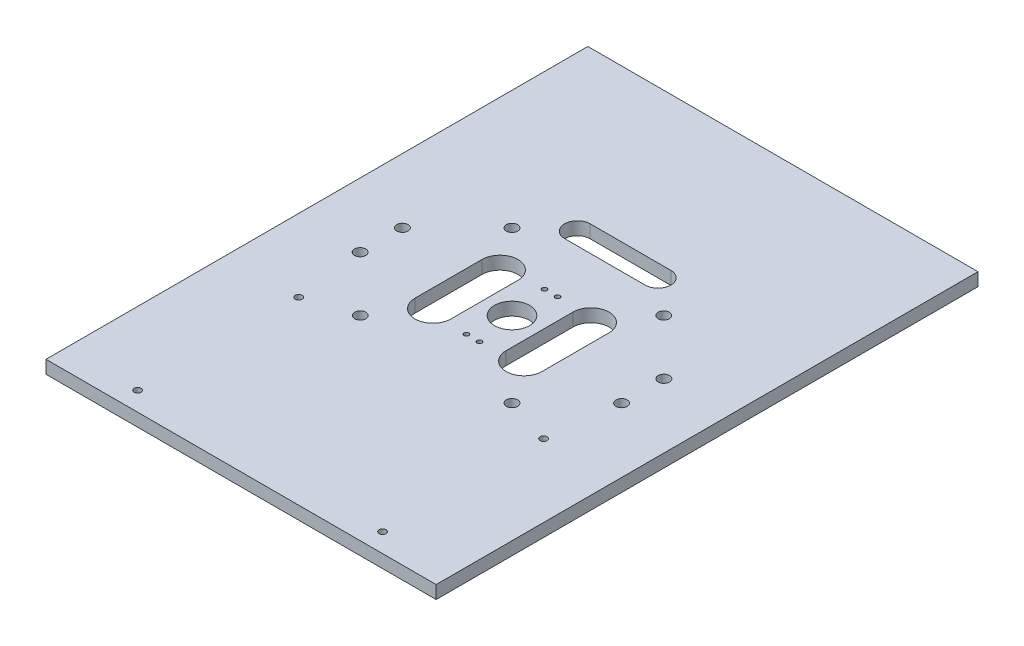
from build123d import *

# Parameters (mm, degrees)
SKETCH_1_W           = 80
SKETCH_1_H           = 80
EXTRUDE_1_DEPTH      = 2
SKETCH_2_R           = 2.5
CUT_EXTRUDE_1_DEPTH  = 2
SKETCH_3_R           = 1
CUT_EXTRUDE_2_DEPTH  = 2
SKETCH_4_R           = 8
CUT_EXTRUDE_3_DEPTH  = 2
SKETCH_5_R           = 2.6
SKETCH_5_R_2         = 1.1
CUT_EXTRUDE_4_DEPTH  = 10
CUT_EXTRUDE_5_DEPTH  = 10
SKETCH_7_W           = 125
SKETCH_7_H           = 125
SKETCH_7_R           = 1.1
SKETCH_7_R_2         = 2.6
SKETCH_7_R_3         = 8
EXTRUDE_2_DEPTH      = 2
SKETCH_8_W           = 250
SKETCH_8_H           = 250
SKETCH_8_R           = 1.1
SKETCH_8_R_2         = 8
EXTRUDE_4_DEPTH      = 2
CUT_EXTRUDE_7_DEPTH  = 70
SKETCH_13_R          = 2.6
CUT_EXTRUDE_10_DEPTH = 61.5
EXTRUDE_5_DEPTH      = 2
CUT_EXTRUDE_12_DEPTH = 2
SKETCH_17_R          = 1.1
EXTRUDE_6_DEPTH      = 2
SKETCH_18_R          = 1.1
CUT_EXTRUDE_13_DEPTH = 2
SKETCH_20_W          = 120.1
SKETCH_20_H          = 80.3
CUT_EXTRUDE_14_DEPTH = 0.5
SKETCH_21_R          = 1.6
CUT_EXTRUDE_15_DEPTH = 10
SKETCH_19_R          = 2.6
CUT_EXTRUDE_16_DEPTH = 10
SKETCH_24_R          = 8.1
CUT_EXTRUDE_19_DEPTH = 10
CUT_EXTRUDE_20_DEPTH = 10
SKETCH_25_R          = 2.6
SKETCH_25_W          = 50
SKETCH_25_H          = 250
CUT_EXTRUDE_21_DEPTH = 18
SKETCH_29_W          = 15
SKETCH_29_H          = 250
EXTRUDE_9_DEPTH      = 2
SKETCH_31_W          = 180
SKETCH_31_H          = 250
SKETCH_31_R          = 1.6
SKETCH_31_R_2        = 2.6
SKETCH_31_R_3        = 1.1
SKETCH_31_R_4        = 8.1
EXTRUDE_10_DEPTH     = 4
CUT_EXTRUDE_22_DEPTH = 56
SKETCH_33_R          = 2.6
EXTRUDE_11_DEPTH     = 6
SKETCH_34_R          = 2.6
CUT_EXTRUDE_23_DEPTH = 10
SKETCH_35_R          = 2.6
EXTRUDE_12_DEPTH     = 6
SKETCH_36_R          = 2.6
CUT_EXTRUDE_24_DEPTH = 20


with BuildPart() as part:
    # 草图1 → 凸台-拉伸1 (new body)
    with BuildSketch(Plane(origin=(0, 0, 0), x_dir=(1, 0, 0), z_dir=(0, 1, 0))):
        Rectangle(SKETCH_1_W, SKETCH_1_H)
    extrude(amount=EXTRUDE_1_DEPTH)

    # 草图2 → 切除-拉伸1 (cut)
    with BuildSketch(Plane(origin=(0, 2, 0), x_dir=(1, 0, 0), z_dir=(0, 1, 0))):
        with Locations(Location((-33, -33, 0), (0, 0, 270))):
            Circle(SKETCH_2_R)
        with Locations(Location((-33, 33, 0), (0, 0, 270))):
            Circle(SKETCH_2_R)
        with Locations(Location((33, 33.941041699, 0), (0, 0, 270))):
            Circle(SKETCH_2_R)
        with Locations(Location((33, -33, 0), (0, 0, 270))):
            Circle(SKETCH_2_R)
    extrude(amount=-CUT_EXTRUDE_1_DEPTH, mode=Mode.SUBTRACT)

    # 草图3 → 切除-拉伸2 (cut)
    with BuildSketch(Plane.XZ):
        with Locations(Location((-2.5, 17.5, 0), (0, 0, 270))):
            Circle(SKETCH_3_R)
        with Locations(Location((2.5, 17.5, 0), (0, 0, 270))):
            Circle(SKETCH_3_R)
        with Locations(Location((-2.5, -17.5, 0), (0, 0, 270))):
            Circle(SKETCH_3_R)
        with Locations(Location((2.5, -17.5, 0), (0, 0, 270))):
            Circle(SKETCH_3_R)
    extrude(amount=-CUT_EXTRUDE_2_DEPTH, mode=Mode.SUBTRACT)

    # 草图4 → 切除-拉伸3 (cut)
    with BuildSketch(Plane.XZ):
        with Locations(Location((0, 0, 0), (0, 0, 270))):
            Circle(SKETCH_4_R)
    extrude(amount=-CUT_EXTRUDE_3_DEPTH, mode=Mode.SUBTRACT)

    # 草图5 → 切除-拉伸4 (cut)
    with BuildSketch(Plane.XZ):
        with Locations(Location((33, 33, 0), (0, 0, 270))):
            Circle(SKETCH_5_R)
        with Locations(Location((33, -33.941041699, 0), (0, 0, 270))):
            Circle(SKETCH_5_R)
        with Locations(Location((-33, -33, 0), (0, 0, 270))):
            Circle(SKETCH_5_R)
        with Locations(Location((-33, 33, 0), (0, 0, 270))):
            Circle(SKETCH_5_R)
        with Locations(Location((-2.5, 17.5, 0), (0, 0, 270))):
            Circle(SKETCH_5_R_2)
        with Locations(Location((2.5, 17.5, 0), (0, 0, 270))):
            Circle(SKETCH_5_R_2)
        with Locations(Location((2.5, -17.5, 0), (0, 0, 270))):
            Circle(SKETCH_5_R_2)
        with Locations(Location((-2.5, -17.5, 0), (0, 0, 270))):
            Circle(SKETCH_5_R_2)
    extrude(amount=-CUT_EXTRUDE_4_DEPTH, mode=Mode.SUBTRACT)

    # 草图6 → 切除-拉伸5 (cut)
    with BuildSketch(Plane.XZ):
        with BuildLine():
            Line((10.300693074, -30.535556058), (-10.300693074, -30.535556058))
            ThreePointArc((-10.300693074, -30.535556058), (-14.372100549, -26.464148583), (-10.300693074, -22.392741109))
            Line((-10.300693074, -22.392741109), (10.300693074, -22.392741109))
            ThreePointArc((10.300693074, -22.392741109), (14.372100549, -26.464148583), (10.300693074, -30.535556058))
        make_face()
    extrude(amount=-CUT_EXTRUDE_5_DEPTH, mode=Mode.SUBTRACT)

    # 草图7 → 凸台-拉伸2 (add)
    with BuildSketch(Plane.XZ):
        Rectangle(SKETCH_7_W, SKETCH_7_H)
        with Locations(Location((2.5, 17.5, 0), (0, 0, 270))):
            Circle(SKETCH_7_R, mode=Mode.SUBTRACT)
        with Locations(Location((-2.5, 17.5, 0), (0, 0, 270))):
            Circle(SKETCH_7_R, mode=Mode.SUBTRACT)
        with Locations(Location((-33, -33, 0), (0, 0, 270))):
            Circle(SKETCH_7_R_2, mode=Mode.SUBTRACT)
        with Locations(Location((-2.5, -17.5, 0), (0, 0, 270))):
            Circle(SKETCH_7_R, mode=Mode.SUBTRACT)
        with Locations(Location((2.5, -17.5, 0), (0, 0, 270))):
            Circle(SKETCH_7_R, mode=Mode.SUBTRACT)
        with Locations(Location((0, 0, 0), (0, 0, 270))):
            Circle(SKETCH_7_R_3, mode=Mode.SUBTRACT)
        with Locations(Location((33, -33.941041699, 0), (0, 0, 270))):
            Circle(SKETCH_7_R_2, mode=Mode.SUBTRACT)
        with Locations(Location((33, 33, 0), (0, 0, 270))):
            Circle(SKETCH_7_R_2, mode=Mode.SUBTRACT)
        with Locations(Location((-33, 33, 0), (0, 0, 270))):
            Circle(SKETCH_7_R_2, mode=Mode.SUBTRACT)
        with BuildLine():
            Line((-10.300693074, -30.535556058), (10.300693074, -30.535556058))
            ThreePointArc((10.300693074, -30.535556058), (14.372100549, -26.464148583), (10.300693074, -22.392741109))
            Line((10.300693074, -22.392741109), (-10.300693074, -22.392741109))
            ThreePointArc((-10.300693074, -22.392741109), (-14.372100549, -26.464148583), (-10.300693074, -30.535556058))
        make_face(mode=Mode.SUBTRACT)
    extrude(amount=-EXTRUDE_2_DEPTH)

    # 草图8 → 凸台-拉伸4 (add)
    with BuildSketch(Plane.XZ):
        Rectangle(SKETCH_8_W, SKETCH_8_H)
        with Locations(Location((2.5, -17.5, 0), (0, 0, 270))):
            Circle(SKETCH_8_R, mode=Mode.SUBTRACT)
        with Locations(Location((-2.5, -17.5, 0), (0, 0, 270))):
            Circle(SKETCH_8_R, mode=Mode.SUBTRACT)
        with Locations(Location((-2.5, 17.5, 0), (0, 0, 270))):
            Circle(SKETCH_8_R, mode=Mode.SUBTRACT)
        with Locations(Location((2.5, 17.5, 0), (0, 0, 270))):
            Circle(SKETCH_8_R, mode=Mode.SUBTRACT)
        with Locations(Location((0, 0, 0), (0, 0, 270))):
            Circle(SKETCH_8_R_2, mode=Mode.SUBTRACT)
    extrude(amount=-EXTRUDE_4_DEPTH)

    # 草图11 → 切除-拉伸7 (cut)
    with BuildSketch(Plane.XZ):
        with BuildLine():
            Line((25, -55.462499596), (-25, -55.462499596))
            ThreePointArc((-25, -55.462499596), (-40, -40.462499596), (-25, -25.462499596))
            Line((-25, -25.462499596), (25, -25.462499596))
            ThreePointArc((25, -25.462499596), (40, -40.462499596), (25, -55.462499596))
        make_face()
    extrude(amount=-CUT_EXTRUDE_7_DEPTH, mode=Mode.SUBTRACT)

    # 草图13 → 切除-拉伸10 (cut)
    with BuildSketch(Plane.XZ):
        with Locations(Location((-105, -105, 0), (0, 0, 270))):
            Circle(SKETCH_13_R)
        with Locations(Location((-105, 105, 0), (0, 0, 270))):
            Circle(SKETCH_13_R)
        with Locations(Location((105, 105, 0), (0, 0, 270))):
            Circle(SKETCH_13_R)
        with Locations(Location((105, -105, 0), (0, 0, 270))):
            Circle(SKETCH_13_R)
    extrude(amount=-CUT_EXTRUDE_10_DEPTH, mode=Mode.SUBTRACT)

    # 草图14 → 凸台-拉伸5 (add)
    with BuildSketch(Plane.XZ):
        with BuildLine():
            Line((25, -55.462499596), (-25, -55.462499596))
            ThreePointArc((-25, -55.462499596), (-40, -40.462499596), (-25, -25.462499596))
            Line((-25, -25.462499596), (25, -25.462499596))
            ThreePointArc((25, -25.462499596), (40, -40.462499596), (25, -55.462499596))
        make_face()
    extrude(amount=-EXTRUDE_5_DEPTH)

    # 草图16 → 切除-拉伸12 (cut)
    with BuildSketch(Plane(origin=(0, 0, 0), x_dir=(-1, 0, 0), z_dir=(0, -1, 0))):
        with BuildLine():
            Line((-12.691318962, 15.449537291), (-12.691318962, -15.449537291))
            ThreePointArc((-12.691318962, -15.449537291), (-21, -23.758218329), (-29.308681038, -15.449537291))
            Line((-29.308681038, -15.449537291), (-29.308681038, 15.449537291))
            ThreePointArc((-29.308681038, 15.449537291), (-21, 23.758218329), (-12.691318962, 15.449537291))
        make_face()
        with BuildLine():
            Line((12.691318962, -15.449537291), (12.691318962, 15.449537291))
            ThreePointArc((12.691318962, 15.449537291), (21, 23.758218329), (29.308681038, 15.449537291))
            Line((29.308681038, 15.449537291), (29.308681038, -15.449537291))
            ThreePointArc((29.308681038, -15.449537291), (21, -23.758218329), (12.691318962, -15.449537291))
        make_face()
    extrude(amount=-CUT_EXTRUDE_12_DEPTH, mode=Mode.SUBTRACT)

    # 草图17 → 凸台-拉伸6 (add)
    with BuildSketch(Plane.XZ):
        with Locations((2.5, -17.5)):
            Circle(SKETCH_17_R)
        with Locations((-2.5, -17.5)):
            Circle(SKETCH_17_R)
        with Locations((2.5, 17.5)):
            Circle(SKETCH_17_R)
        with Locations((-2.5, 17.5)):
            Circle(SKETCH_17_R)
    extrude(amount=-EXTRUDE_6_DEPTH)

    # 草图18 → 切除-拉伸13 (cut)
    with BuildSketch(Plane.XZ):
        with Locations(Location((3, 18, 0), (0, 0, 270))):
            Circle(SKETCH_18_R)
        with Locations(Location((-3, 18, 0), (0, 0, 270))):
            Circle(SKETCH_18_R)
        with Locations(Location((-3, -18, 0), (0, 0, 270))):
            Circle(SKETCH_18_R)
        with Locations(Location((3, -18, 0), (0, 0, 270))):
            Circle(SKETCH_18_R)
    extrude(amount=-CUT_EXTRUDE_13_DEPTH, mode=Mode.SUBTRACT)

    # 草图20 → 切除-拉伸14 (cut)
    with BuildSketch(Plane.XZ):
        with Locations((0, 79.072758312)):
            Rectangle(SKETCH_20_W, SKETCH_20_H)
    extrude(amount=-CUT_EXTRUDE_14_DEPTH, mode=Mode.SUBTRACT)

    # 草图21 → 切除-拉伸15 (cut)
    with BuildSketch(Plane.XZ.offset(-0.5)):
        with Locations(Location((-56.5, 116.222758312, 0), (0, 0, 270))):
            Circle(SKETCH_21_R)
        with Locations(Location((-56.5, 41.922758312, 0), (0, 0, 270))):
            Circle(SKETCH_21_R)
        with Locations(Location((56.5, 116.222758312, 0), (0, 0, 270))):
            Circle(SKETCH_21_R)
        with Locations(Location((56.5, 41.922758312, 0), (0, 0, 270))):
            Circle(SKETCH_21_R)
    extrude(amount=-CUT_EXTRUDE_15_DEPTH, mode=Mode.SUBTRACT)

    # 草图19 → 切除-拉伸16 (cut)
    with BuildSketch(Plane.XZ):
        with Locations(Location((-35, 35, 0), (0, 0, 270))):
            Circle(SKETCH_19_R)
        with Locations(Location((35, 34.434809636, 0), (0, 0, 270))):
            Circle(SKETCH_19_R)
        with Locations(Location((35, -35, 0), (0, 0, 270))):
            Circle(SKETCH_19_R)
        with Locations(Location((-35, -35, 0), (0, 0, 270))):
            Circle(SKETCH_19_R)
    extrude(amount=-CUT_EXTRUDE_16_DEPTH, mode=Mode.SUBTRACT)

    # 草图24 → 切除-拉伸19 (cut)
    with BuildSketch(Plane.XZ):
        with Locations(Location((0, 0, 0), (0, 0, 270))):
            Circle(SKETCH_24_R)
    extrude(amount=-CUT_EXTRUDE_19_DEPTH, mode=Mode.SUBTRACT)

    # 草图22 → 切除-拉伸20 (cut)
    with BuildSketch(Plane.XZ):
        with BuildLine():
            Line((18.597051427, -54.678850568), (-18.597051427, -54.678850568))
            ThreePointArc((-18.597051427, -54.678850568), (-24.503368167, -48.772533828), (-18.597051427, -42.866217089))
            Line((-18.597051427, -42.866217089), (18.597051427, -42.866217089))
            ThreePointArc((18.597051427, -42.866217089), (24.503368167, -48.772533828), (18.597051427, -54.678850568))
        make_face()
    extrude(amount=-CUT_EXTRUDE_20_DEPTH, mode=Mode.SUBTRACT)

    # 草图25 → 切除-拉伸21 (cut)
    with BuildSketch(Plane(origin=(0, 0, 0), x_dir=(-1, 0, 0), z_dir=(0, -1, 0))):
        with Locations(Location((60.308681038, -9.5, 0), (0, 0, 90))):
            Circle(SKETCH_25_R)
        with Locations(Location((60.308681038, 9.5, 0), (0, 0, 90))):
            Circle(SKETCH_25_R)
        with Locations(Location((-60.308681038, -9, 0), (0, 0, 90))):
            Circle(SKETCH_25_R)
        with Locations(Location((-60.308681038, 9, 0), (0, 0, 90))):
            Circle(SKETCH_25_R)
        with Locations((100, 0)):
            Rectangle(SKETCH_25_W, SKETCH_25_H)
        with Locations((-100, 0)):
            Rectangle(SKETCH_25_W, SKETCH_25_H)
    extrude(amount=-CUT_EXTRUDE_21_DEPTH, mode=Mode.SUBTRACT)

    # 草图29 → 凸台-拉伸9 (add)
    with BuildSketch(Plane(origin=(0, 0, 0), x_dir=(-1, 0, 0), z_dir=(0, -1, 0))):
        with Locations((82.5, 0)):
            Rectangle(SKETCH_29_W, SKETCH_29_H)
        with Locations((-82.5, 0)):
            Rectangle(SKETCH_29_W, SKETCH_29_H)
    extrude(amount=-EXTRUDE_9_DEPTH)

    # 草图31 → 凸台-拉伸10 (add)
    with BuildSketch(Plane(origin=(0, 2, 0), x_dir=(1, 0, 0), z_dir=(0, 1, 0))):
        Rectangle(SKETCH_31_W, SKETCH_31_H)
        with Locations(Location((-56.5, -116.222758312, 0), (0, 0, 90))):
            Circle(SKETCH_31_R, mode=Mode.SUBTRACT)
        with Locations(Location((56.5, -116.222758312, 0), (0, 0, 90))):
            Circle(SKETCH_31_R, mode=Mode.SUBTRACT)
        with Locations(Location((56.5, -41.922758312, 0), (0, 0, 90))):
            Circle(SKETCH_31_R, mode=Mode.SUBTRACT)
        with Locations(Location((35, -34.434809636, 0), (0, 0, 90))):
            Circle(SKETCH_31_R_2, mode=Mode.SUBTRACT)
        with Locations(Location((60.308681038, -9, 0), (0, 0, 90))):
            Circle(SKETCH_31_R_2, mode=Mode.SUBTRACT)
        with Locations(Location((60.308681038, 9, 0), (0, 0, 90))):
            Circle(SKETCH_31_R_2, mode=Mode.SUBTRACT)
        with Locations(Location((35, 35, 0), (0, 0, 90))):
            Circle(SKETCH_31_R_2, mode=Mode.SUBTRACT)
        with Locations(Location((3, -18, 0), (0, 0, 90))):
            Circle(SKETCH_31_R_3, mode=Mode.SUBTRACT)
        with Locations(Location((-3, -18, 0), (0, 0, 90))):
            Circle(SKETCH_31_R_3, mode=Mode.SUBTRACT)
        with Locations(Location((-3, 18, 0), (0, 0, 90))):
            Circle(SKETCH_31_R_3, mode=Mode.SUBTRACT)
        with Locations(Location((3, 18, 0), (0, 0, 90))):
            Circle(SKETCH_31_R_3, mode=Mode.SUBTRACT)
        with Locations(Location((0, 0, 0), (0, 0, 90))):
            Circle(SKETCH_31_R_4, mode=Mode.SUBTRACT)
        with Locations(Location((-35, -35, 0), (0, 0, 90))):
            Circle(SKETCH_31_R_2, mode=Mode.SUBTRACT)
        with Locations(Location((-56.5, -41.922758312, 0), (0, 0, 90))):
            Circle(SKETCH_31_R, mode=Mode.SUBTRACT)
        with Locations(Location((-60.308681038, -9.5, 0), (0, 0, 90))):
            Circle(SKETCH_31_R_2, mode=Mode.SUBTRACT)
        with Locations(Location((-60.308681038, 9.5, 0), (0, 0, 90))):
            Circle(SKETCH_31_R_2, mode=Mode.SUBTRACT)
        with Locations(Location((-35, 35, 0), (0, 0, 90))):
            Circle(SKETCH_31_R_2, mode=Mode.SUBTRACT)
        with BuildLine():
            Line((-29.308681038, -15.449537291), (-29.308681038, 15.449537291))
            ThreePointArc((-29.308681038, 15.449537291), (-21, 23.758218329), (-12.691318962, 15.449537291))
            Line((-12.691318962, 15.449537291), (-12.691318962, -15.449537291))
            ThreePointArc((-12.691318962, -15.449537291), (-21, -23.758218329), (-29.308681038, -15.449537291))
        make_face(mode=Mode.SUBTRACT)
        with BuildLine():
            Line((18.597051427, 54.678850568), (-18.597051427, 54.678850568))
            ThreePointArc((-18.597051427, 54.678850568), (-24.503368167, 48.772533828), (-18.597051427, 42.866217089))
            Line((-18.597051427, 42.866217089), (18.597051427, 42.866217089))
            ThreePointArc((18.597051427, 42.866217089), (24.503368167, 48.772533828), (18.597051427, 54.678850568))
        make_face(mode=Mode.SUBTRACT)
    extrude(amount=EXTRUDE_10_DEPTH)

    # 草图32 → 切除-拉伸22 (cut)
    with BuildSketch(Plane.XZ.offset(-2)):
        with BuildLine():
            ThreePointArc((29.308681038, 15.449537291), (26.875124704, 21.324661996), (21, 23.758218329))
            Line((21, 23.758218329), (21, -23.758218329))
            ThreePointArc((21, -23.758218329), (26.875124704, -21.324661996), (29.308681038, -15.449537291))
            Line((29.308681038, -15.449537291), (29.308681038, 15.449537291))
        make_face()
        with BuildLine():
            Line((21, -23.758218329), (21, 23.758218329))
            ThreePointArc((21, 23.758218329), (15.124875296, 21.324661996), (12.691318962, 15.449537291))
            Line((12.691318962, 15.449537291), (12.691318962, -15.449537291))
            ThreePointArc((12.691318962, -15.449537291), (15.124875296, -21.324661996), (21, -23.758218329))
        make_face()
    extrude(amount=-CUT_EXTRUDE_22_DEPTH, mode=Mode.SUBTRACT)

    # 草图33 → 凸台-拉伸11 (add)
    with BuildSketch(Plane.XZ):
        with Locations((-35, 35)):
            Circle(SKETCH_33_R)
        with Locations((35, 34.434809636)):
            Circle(SKETCH_33_R)
    extrude(amount=-EXTRUDE_11_DEPTH)

    # 草图34 → 切除-拉伸23 (cut)
    with BuildSketch(Plane.XZ):
        with Locations(Location((-35, 35, 0), (0, 0, 270))):
            Circle(SKETCH_34_R)
        with Locations(Location((35, 35, 0), (0, 0, 270))):
            Circle(SKETCH_34_R)
    extrude(amount=-CUT_EXTRUDE_23_DEPTH, mode=Mode.SUBTRACT)

    # 草图35 → 凸台-拉伸12 (add)
    with BuildSketch(Plane.XZ):
        with Locations((-60.308681038, 9.5)):
            Circle(SKETCH_35_R)
        with Locations((-60.308681038, -9.5)):
            Circle(SKETCH_35_R)
        with Locations((60.308681038, 9)):
            Circle(SKETCH_35_R)
        with Locations((60.308681038, -9)):
            Circle(SKETCH_35_R)
    extrude(amount=-EXTRUDE_12_DEPTH)

    # 草图36 → 切除-拉伸24 (cut)
    with BuildSketch(Plane.XZ):
        with Locations(Location((-60.308681038, 9.75, 0), (0, 0, 270))):
            Circle(SKETCH_36_R)
        with Locations(Location((-60.308681038, -9.75, 0), (0, 0, 270))):
            Circle(SKETCH_36_R)
        with Locations(Location((60.308681038, 9.75, 0), (0, 0, 270))):
            Circle(SKETCH_36_R)
        with Locations(Location((60.308681038, -9.75, 0), (0, 0, 270))):
            Circle(SKETCH_36_R)
    extrude(amount=-CUT_EXTRUDE_24_DEPTH, mode=Mode.SUBTRACT)


solid = part.part
